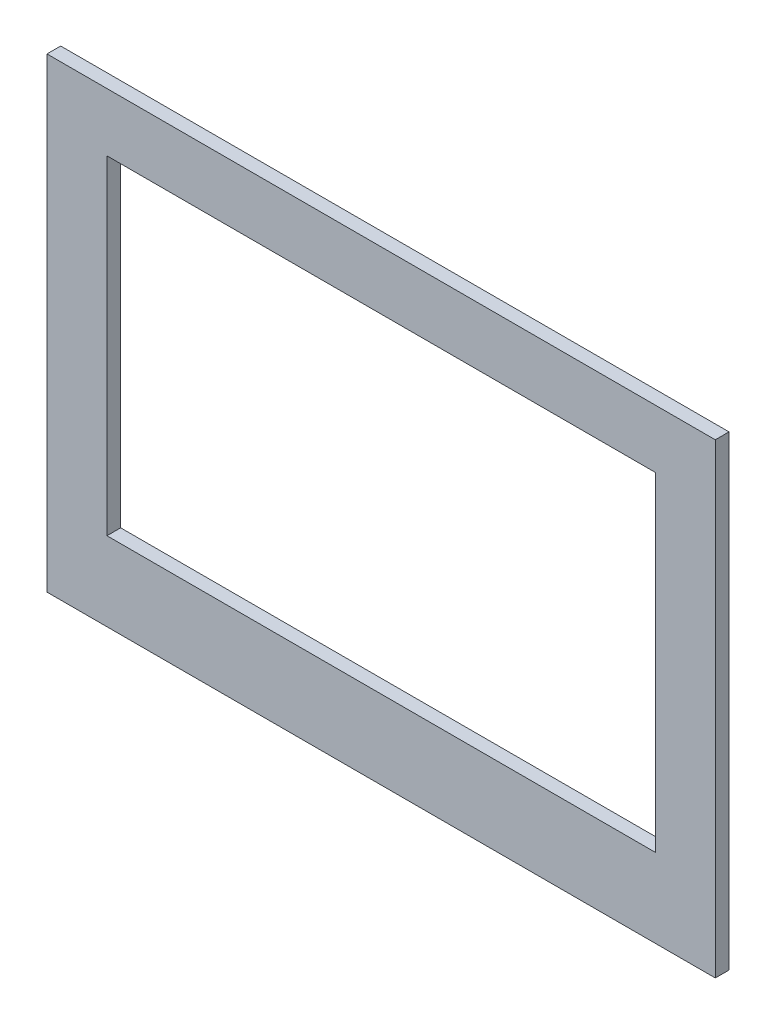
from build123d import *
from build123d.topology import SkipClean

# Parameters (mm, degrees)
SKETCH1_W               = 195
SKETCH1_H               = 136
SKETCH1_W_2             = 160
SKETCH1_H_2             = 96
BOSS_EXTRUDE1_DEPTH     = 2
SKETCH1_3_W             = 195
SKETCH1_3_H             = 136
SKETCH1_3_W_2           = 160
SKETCH1_3_H_2           = 96
BOSS_EXTRUDE2_DEPTH     = 2
CUT_EXTRUDE1_DEPTH      = 1.375
CUT_EXTRUDE1_DEPTH_BACK = 1.375
SKETCH2_R               = 3.25


with BuildPart() as part:
    # Sketch1 → Boss-Extrude1 (new body)
    with BuildSketch(Plane.XY):
        Rectangle(SKETCH1_W, SKETCH1_H)
        with Locations((0, 3)):
            Rectangle(SKETCH1_W_2, SKETCH1_H_2, mode=Mode.SUBTRACT)
    extrude(amount=-BOSS_EXTRUDE1_DEPTH)

    # Sketch1<3> → Boss-Extrude2 (add)
    with BuildSketch(Plane.XY):
        Rectangle(SKETCH1_3_W, SKETCH1_3_H)
        with Locations((0, 3)):
            Rectangle(SKETCH1_3_W_2, SKETCH1_3_H_2, mode=Mode.SUBTRACT)
    extrude(amount=BOSS_EXTRUDE2_DEPTH)

    # Sketch2 → Cut-Extrude1 (cut, two sides: drawn at the far end of the back side and taken through both)
    with SkipClean():  # the faces are left unmerged after this step: merging them gives an invalid solid
        with BuildSketch(Plane.XY.offset(-CUT_EXTRUDE1_DEPTH_BACK)):
            with Locations((-90.5, 61)):
                Circle(SKETCH2_R)
            with Locations((90.5, 61)):
                Circle(SKETCH2_R)
            with Locations((-30.166666667, -61)):
                Circle(SKETCH2_R)
            with Locations((30.166666667, -61)):
                Circle(SKETCH2_R)
            with Locations((90.5, 0)):
                Circle(SKETCH2_R)
            with Locations((-30.166666667, 61)):
                Circle(SKETCH2_R)
            with Locations((30.166666667, 61)):
                Circle(SKETCH2_R)
            with Locations((-90.5, 0)):
                Circle(SKETCH2_R)
        extrude(amount=CUT_EXTRUDE1_DEPTH + CUT_EXTRUDE1_DEPTH_BACK, mode=Mode.SUBTRACT)


solid = part.part
